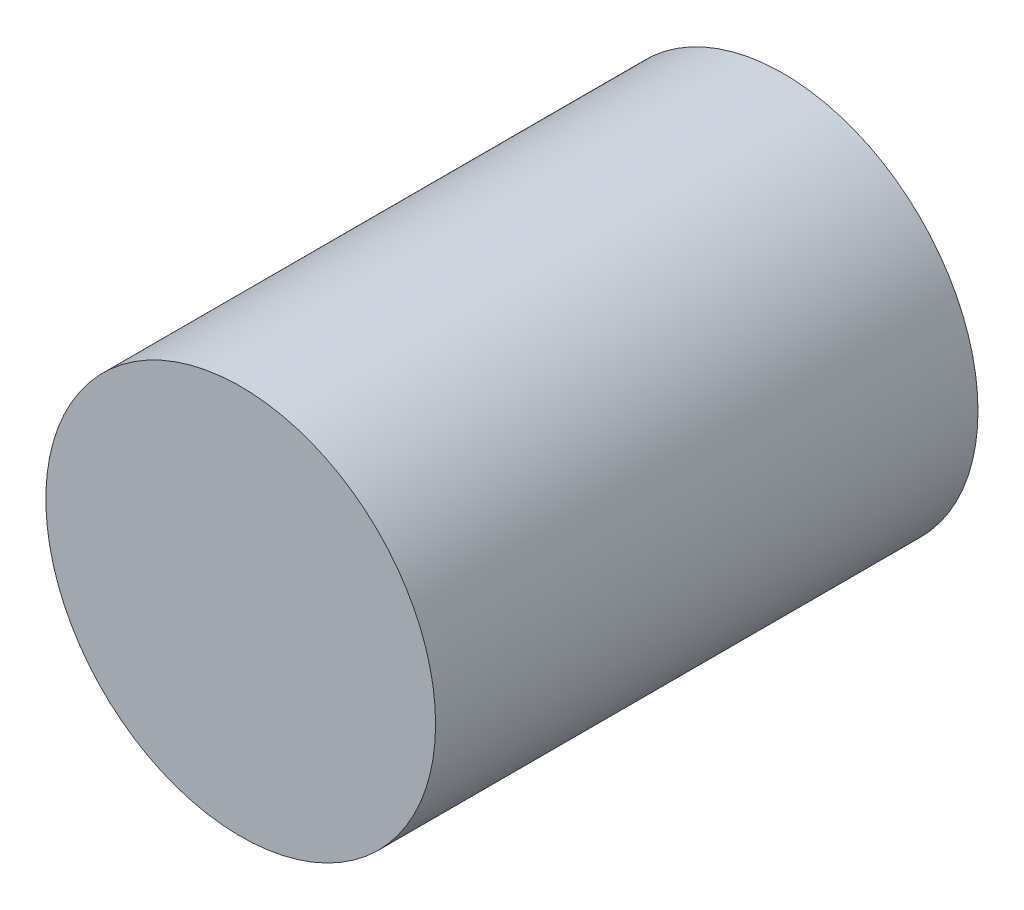
from build123d import *

# Parameters (mm, degrees)
SKETCH1_R           = 3
BOSS_EXTRUDE1_DEPTH = 8.35


with BuildPart() as part:
    # Sketch1 → Boss-Extrude1 (new body)
    with BuildSketch(Plane.XY):
        Circle(SKETCH1_R)
    extrude(amount=BOSS_EXTRUDE1_DEPTH)


solid = part.part
